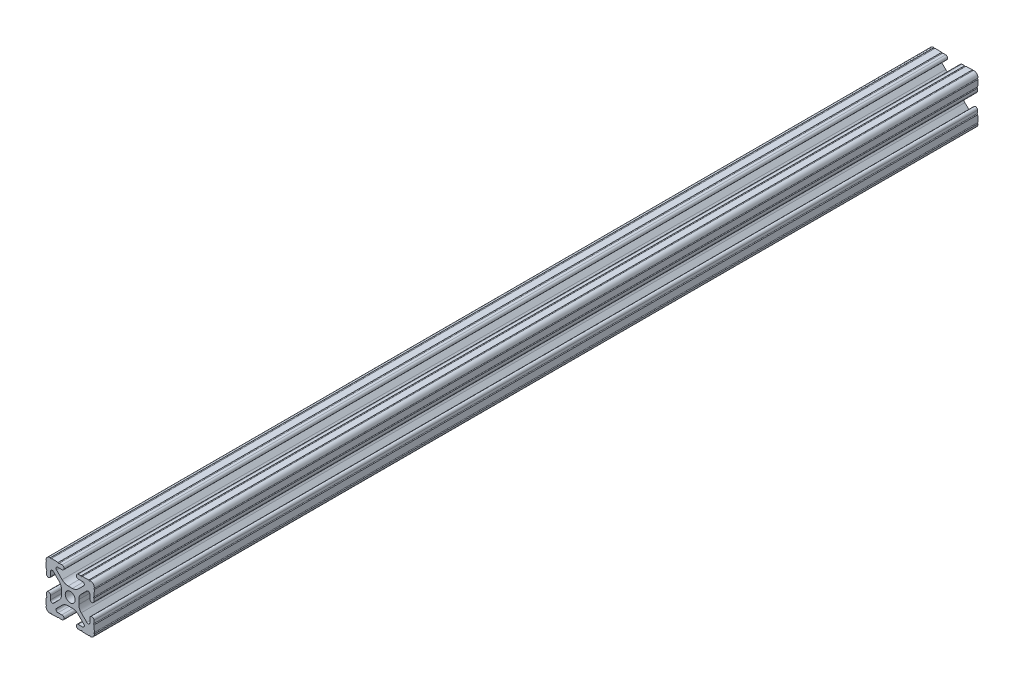
from build123d import *

# Parameters (mm, degrees)
SKETCH3_R      = 2.6035
EXTRUDE1_DEPTH = 232


with BuildPart() as part:
    # Sketch3 → Extrude1 (new, symmetric)
    with BuildSketch(Plane.XY):
        with BuildLine():
            Line((-1.115277175, 4.5085), (1.115277175, 4.5085))
            ThreePointArc((1.115277175, 4.5085), (2.806584872, 4.844922018), (4.240406305, 5.80297087))
            Line((4.240406305, 5.80297087), (7.148423664, 8.710988229))
            ThreePointArc((7.148423664, 8.710988229), (7.349906316, 9.772227925), (6.436353897, 10.348636575))
            Line((6.436353897, 10.348636575), (4.381960454, 10.276895575))
            ThreePointArc((4.381960454, 10.276895575), (3.239173075, 11.342562046), (4.304839546, 12.485349424))
            Line((4.304839546, 12.485349424), (5.728246175, 12.535055879))
            ThreePointArc((5.728246175, 12.535055879), (6.054756855, 12.230579745), (6.35923299, 12.557090424))
            Line((6.35923299, 12.557090424), (9.782092278, 12.676619304))
            ThreePointArc((9.782092278, 12.676619304), (10.108602958, 12.37214317), (10.413079092, 12.69865385))
            ThreePointArc((10.413079092, 12.69865385), (12.052764565, 12.052764565), (12.69865385, 10.413079092))
            ThreePointArc((12.69865385, 10.413079092), (12.37214317, 10.108602958), (12.676619304, 9.782092278))
            Line((12.676619304, 9.782092278), (12.557090424, 6.35923299))
            ThreePointArc((12.557090424, 6.35923299), (12.230579745, 6.054756855), (12.535055879, 5.728246175))
            Line((12.535055879, 5.728246175), (12.485349424, 4.304839546))
            ThreePointArc((12.485349424, 4.304839546), (11.342562046, 3.239173075), (10.276895575, 4.381960454))
            Line((10.276895575, 4.381960454), (10.348636575, 6.436353897))
            ThreePointArc((10.348636575, 6.436353897), (9.772227925, 7.349906316), (8.710988229, 7.148423664))
            Line((8.710988229, 7.148423664), (5.80297087, 4.240406305))
            ThreePointArc((5.80297087, 4.240406305), (4.844922018, 2.806584872), (4.5085, 1.115277175))
            Line((4.5085, 1.115277175), (4.5085, -1.115277175))
            ThreePointArc((4.5085, -1.115277175), (4.844922018, -2.806584872), (5.80297087, -4.240406305))
            Line((5.80297087, -4.240406305), (8.710988229, -7.148423664))
            ThreePointArc((8.710988229, -7.148423664), (9.772227925, -7.349906316), (10.348636575, -6.436353897))
            Line((10.348636575, -6.436353897), (10.276895575, -4.381960454))
            ThreePointArc((10.276895575, -4.381960454), (11.342562046, -3.239173075), (12.485349424, -4.304839546))
            Line((12.485349424, -4.304839546), (12.535055879, -5.728246175))
            ThreePointArc((12.535055879, -5.728246175), (12.230579745, -6.054756855), (12.557090424, -6.35923299))
            Line((12.557090424, -6.35923299), (12.676619304, -9.782092278))
            ThreePointArc((12.676619304, -9.782092278), (12.37214317, -10.108602958), (12.69865385, -10.413079092))
            ThreePointArc((12.69865385, -10.413079092), (12.052764565, -12.052764565), (10.413079092, -12.69865385))
            ThreePointArc((10.413079092, -12.69865385), (10.108602958, -12.37214317), (9.782092278, -12.676619304))
            Line((9.782092278, -12.676619304), (6.35923299, -12.557090424))
            ThreePointArc((6.35923299, -12.557090424), (6.054756855, -12.230579745), (5.728246175, -12.535055879))
            Line((5.728246175, -12.535055879), (4.304839546, -12.485349424))
            ThreePointArc((4.304839546, -12.485349424), (3.239173075, -11.342562046), (4.381960454, -10.276895575))
            Line((4.381960454, -10.276895575), (6.436353897, -10.348636575))
            ThreePointArc((6.436353897, -10.348636575), (7.349906316, -9.772227925), (7.148423664, -8.710988229))
            Line((7.148423664, -8.710988229), (4.240406305, -5.80297087))
            ThreePointArc((4.240406305, -5.80297087), (2.806584872, -4.844922018), (1.115277175, -4.5085))
            Line((1.115277175, -4.5085), (-1.115277175, -4.5085))
            ThreePointArc((-1.115277175, -4.5085), (-2.806584872, -4.844922018), (-4.240406305, -5.80297087))
            Line((-4.240406305, -5.80297087), (-7.148423664, -8.710988229))
            ThreePointArc((-7.148423664, -8.710988229), (-7.349906316, -9.772227925), (-6.436353897, -10.348636575))
            Line((-6.436353897, -10.348636575), (-4.381960454, -10.276895575))
            ThreePointArc((-4.381960454, -10.276895575), (-3.239173075, -11.342562046), (-4.304839546, -12.485349424))
            Line((-4.304839546, -12.485349424), (-5.728246175, -12.535055879))
            ThreePointArc((-5.728246175, -12.535055879), (-6.054756855, -12.230579745), (-6.35923299, -12.557090424))
            Line((-6.35923299, -12.557090424), (-9.782092278, -12.676619304))
            ThreePointArc((-9.782092278, -12.676619304), (-10.108602958, -12.37214317), (-10.413079092, -12.69865385))
            ThreePointArc((-10.413079092, -12.69865385), (-12.052764565, -12.052764565), (-12.69865385, -10.413079092))
            ThreePointArc((-12.69865385, -10.413079092), (-12.37214317, -10.108602958), (-12.676619304, -9.782092278))
            Line((-12.676619304, -9.782092278), (-12.557090424, -6.35923299))
            ThreePointArc((-12.557090424, -6.35923299), (-12.230579745, -6.054756855), (-12.535055879, -5.728246175))
            Line((-12.535055879, -5.728246175), (-12.485349424, -4.304839546))
            ThreePointArc((-12.485349424, -4.304839546), (-11.342562046, -3.239173075), (-10.276895575, -4.381960454))
            Line((-10.276895575, -4.381960454), (-10.348636575, -6.436353897))
            ThreePointArc((-10.348636575, -6.436353897), (-9.772227925, -7.349906316), (-8.710988229, -7.148423664))
            Line((-8.710988229, -7.148423664), (-5.80297087, -4.240406305))
            ThreePointArc((-5.80297087, -4.240406305), (-4.844922018, -2.806584872), (-4.5085, -1.115277175))
            Line((-4.5085, -1.115277175), (-4.5085, 1.115277175))
            ThreePointArc((-4.5085, 1.115277175), (-4.844922018, 2.806584872), (-5.80297087, 4.240406305))
            Line((-5.80297087, 4.240406305), (-8.710988229, 7.148423664))
            ThreePointArc((-8.710988229, 7.148423664), (-9.772227925, 7.349906316), (-10.348636575, 6.436353897))
            Line((-10.348636575, 6.436353897), (-10.276895575, 4.381960454))
            ThreePointArc((-10.276895575, 4.381960454), (-11.342562046, 3.239173075), (-12.485349424, 4.304839546))
            Line((-12.485349424, 4.304839546), (-12.535055879, 5.728246175))
            ThreePointArc((-12.535055879, 5.728246175), (-12.230579745, 6.054756855), (-12.557090424, 6.35923299))
            Line((-12.557090424, 6.35923299), (-12.676619304, 9.782092278))
            ThreePointArc((-12.676619304, 9.782092278), (-12.37214317, 10.108602958), (-12.69865385, 10.413079092))
            ThreePointArc((-12.69865385, 10.413079092), (-12.052764565, 12.052764565), (-10.413079092, 12.69865385))
            ThreePointArc((-10.413079092, 12.69865385), (-10.108602958, 12.37214317), (-9.782092278, 12.676619304))
            Line((-9.782092278, 12.676619304), (-6.35923299, 12.557090424))
            ThreePointArc((-6.35923299, 12.557090424), (-6.054756855, 12.230579745), (-5.728246175, 12.535055879))
            Line((-5.728246175, 12.535055879), (-4.304839546, 12.485349424))
            ThreePointArc((-4.304839546, 12.485349424), (-3.239173075, 11.342562046), (-4.381960454, 10.276895575))
            Line((-4.381960454, 10.276895575), (-6.436353897, 10.348636575))
            ThreePointArc((-6.436353897, 10.348636575), (-7.349906316, 9.772227925), (-7.148423664, 8.710988229))
            Line((-7.148423664, 8.710988229), (-4.240406305, 5.80297087))
            ThreePointArc((-4.240406305, 5.80297087), (-2.806584872, 4.844922018), (-1.115277175, 4.5085))
        make_face()
        with Locations(Location((0, 0, 0), (0, 0, 180))):
            Circle(SKETCH3_R, mode=Mode.SUBTRACT)
    extrude(amount=EXTRUDE1_DEPTH, both=True)


solid = part.part
